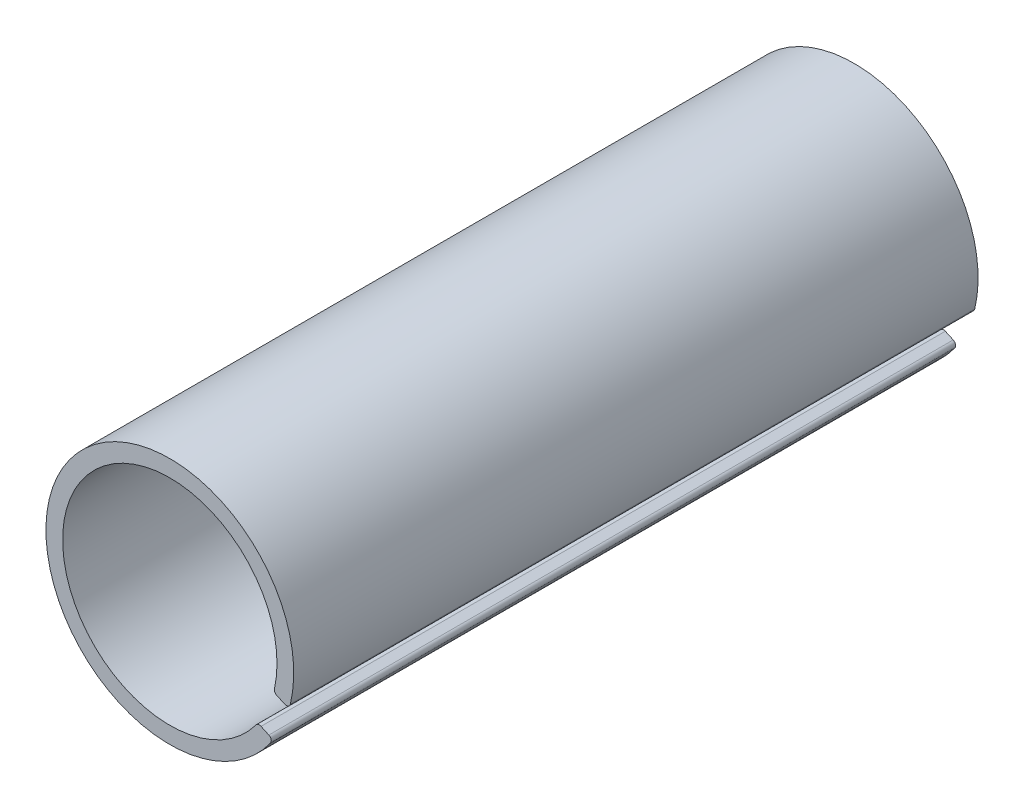
from build123d import *

# Parameters (mm, degrees)
BOSS_EXTRU_3_DEPTH = 83


with BuildPart() as part:
    # Esquisse1 → Boss.-Extru.3 (new body)
    with BuildSketch(Plane.XY):
        with BuildLine():
            Line((13.926414777, -3.806711623), (12.973693151, -3.372870175))
            ThreePointArc((12.973693151, -3.372870175), (12.733506213, -3.141062984), (12.692724073, -2.809760772))
            ThreePointArc((12.692724073, -2.809760772), (-11.829492988, 5.391019908), (10.447719463, -7.735965229))
            ThreePointArc((10.447719463, -7.735965229), (10.724383559, -7.549423688), (11.056794316, -7.57847291))
            Line((11.056794316, -7.57847291), (12.009590144, -8.012416083))
            ThreePointArc((12.009590144, -8.012416083), (12.285475329, -8.338641219), (12.208610947, -8.758911776))
            ThreePointArc((12.208610947, -8.758911776), (-13.672833437, 6.230757786), (14.62013485, -3.467041062))
            ThreePointArc((14.62013485, -3.467041062), (14.353503323, -3.8007296), (13.926414777, -3.806711623))
        make_face()
    extrude(amount=BOSS_EXTRU_3_DEPTH)


solid = part.part
